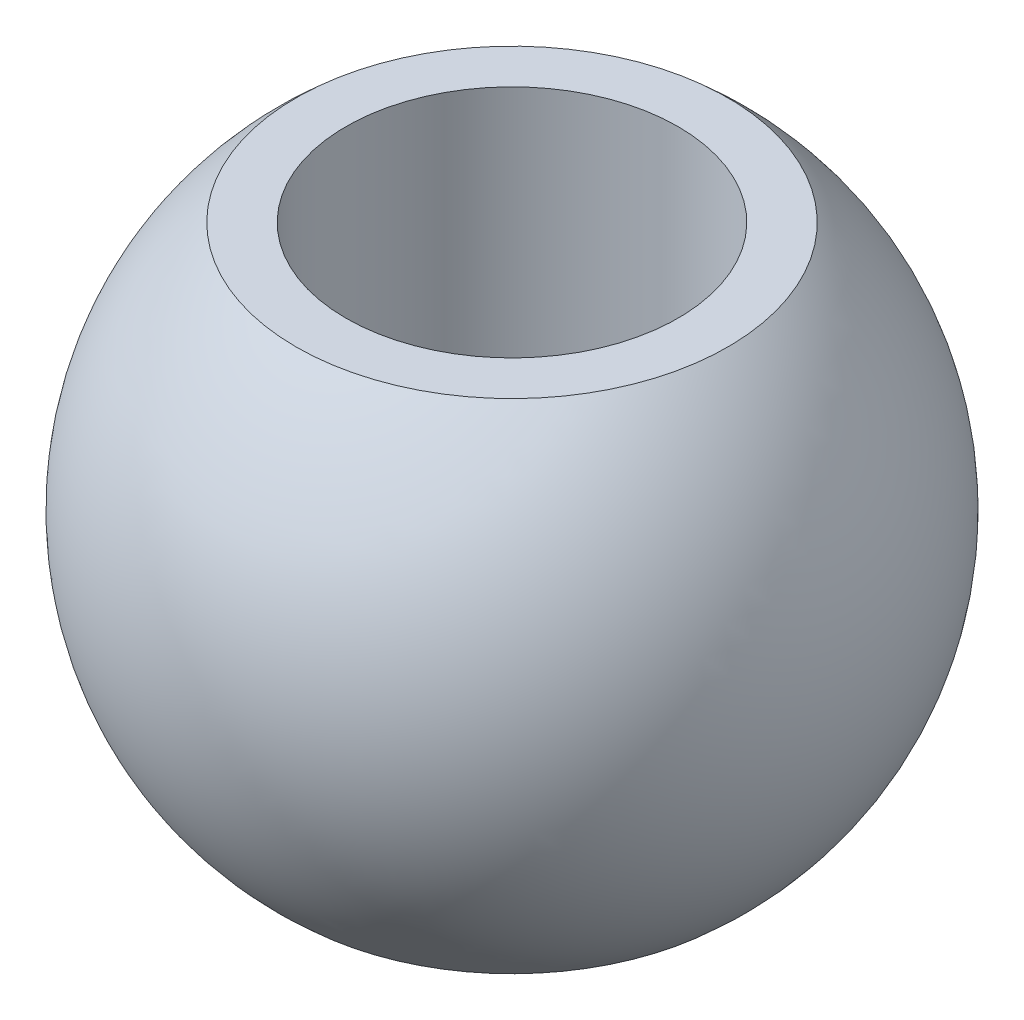
from build123d import *


with BuildPart() as part:
    # Sketch1 → Revolve1 (revolve)
    with BuildSketch(Plane.XY, mode=Mode.PRIVATE) as revolve1_sk:
        with BuildLine():
            Line((-5.2, 12), (-4, 12))
            Line((-4, 12), (-4, 0))
            Line((-4, 0), (-5.2, 0))
            ThreePointArc((-5.2, 0), (-7.940971712, 6), (-5.2, 12))
        make_face()
    revolve(revolve1_sk.sketch.rotate(Axis((0, 12, 0), (0, -1, 0)), 270), axis=Axis((0, 12, 0), (0, -1, 0)))


solid = part.part
